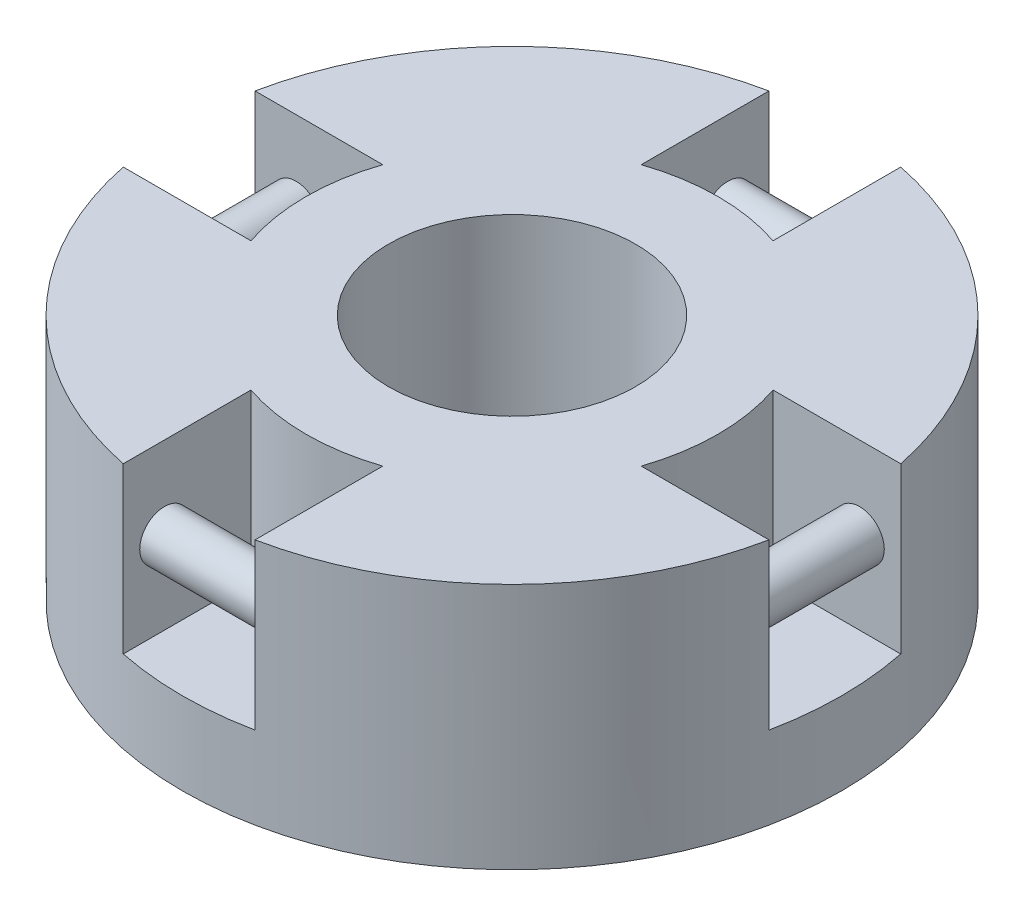
from build123d import *

# Parameters (mm, degrees)
SKETCH1_R           = 20
SKETCH1_R_2         = 7.5
BOSS_EXTRUDE1_DEPTH = 15
CUT_EXTRUDE1_START  = -10
CUT_EXTRUDE1_DEPTH  = 10
SKETCH4_R           = 1.5
BOSS_EXTRUDE2_DEPTH = 10
CIRPATTERN1_COUNT   = 4


with BuildPart() as part:
    # Sketch1 → Boss-Extrude1 (new body)
    with BuildSketch(Plane(origin=(0, 0, 0), x_dir=(1, 0, 0), z_dir=(0, 1, 0))):
        with Locations(Location((0, 0, 0), (0, 0, 270))):
            Circle(SKETCH1_R)
        with Locations(Location((0, 0, 0), (0, 0, 270))):
            Circle(SKETCH1_R_2, mode=Mode.SUBTRACT)
    extrude(amount=BOSS_EXTRUDE1_DEPTH)

    # Sketch2 → Cut-Extrude1 (cut)
    with BuildSketch(Plane(origin=(0, 15, 0), x_dir=(1, 0, 0), z_dir=(0, 1, 0)).offset(CUT_EXTRUDE1_START)):
        with BuildLine():
            Line((-19.595917942, -4), (-11.842719282, -4))
            ThreePointArc((-11.842719282, -4), (-12.5, 0), (-11.842719282, 4))
            Line((-11.842719282, 4), (-19.595917942, 4))
            ThreePointArc((-19.595917942, 4), (-20, 0), (-19.595917942, -4))
        make_face()
        with BuildLine():
            Line((-4, 19.595917942), (-4, 11.842719282))
            ThreePointArc((-4, 11.842719282), (0, 12.5), (4, 11.842719282))
            Line((4, 11.842719282), (4, 19.595917942))
            ThreePointArc((4, 19.595917942), (0, 20), (-4, 19.595917942))
        make_face()
        with BuildLine():
            Line((11.842719282, 4), (19.595917942, 4))
            ThreePointArc((19.595917942, 4), (20, 0), (19.595917942, -4))
            Line((19.595917942, -4), (11.842719282, -4))
            ThreePointArc((11.842719282, -4), (12.5, 0), (11.842719282, 4))
        make_face()
        with BuildLine():
            Line((4, -11.842719282), (4, -19.595917942))
            ThreePointArc((4, -19.595917942), (0, -20), (-4, -19.595917942))
            Line((-4, -19.595917942), (-4, -11.842719282))
            ThreePointArc((-4, -11.842719282), (0, -12.5), (4, -11.842719282))
        make_face()
    extrude(amount=CUT_EXTRUDE1_DEPTH, mode=Mode.SUBTRACT)

    # Sketch4 → Boss-Extrude2 (add)
    with BuildSketch(Plane(origin=(0, 0, 4), x_dir=(-1, 0, 0), z_dir=(0, 0, -1))):
        with Locations(Location((-17.095917942, 10, 0), (0, 0, 180))):
            Circle(SKETCH4_R)
    boss_extrude2 = extrude(amount=BOSS_EXTRUDE2_DEPTH)

    # CirPattern1: Boss-Extrude2 ×4 about axis
    cirpattern1_axis = Axis((0, 15, 0), (0, -1, 0))
    for i in range(1, CIRPATTERN1_COUNT):
        add(boss_extrude2.rotate(cirpattern1_axis, i * 360 / CIRPATTERN1_COUNT))


solid = part.part
